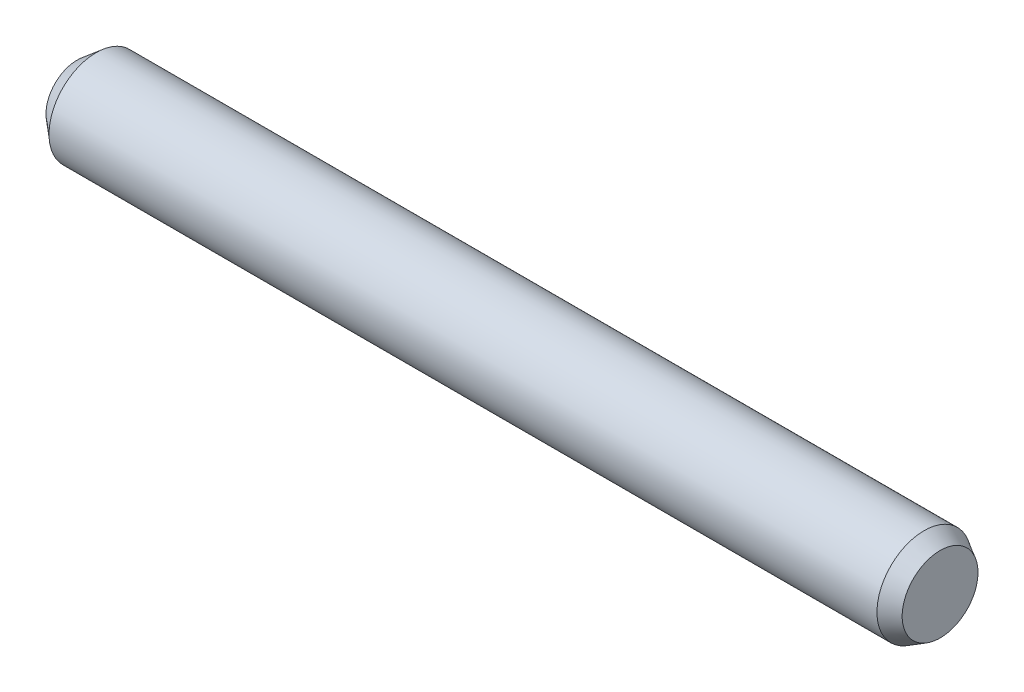
from build123d import *

# Parameters (mm, degrees)
CROQUIS1_R              = 1.475
SALIENTE_EXTRUIR1_DEPTH = 27
CHAFL_N1_SIZE           = 0.5
CHAFL_N1_SIZE2          = 0.288675135
CHAFL_N7_SIZE           = 0.5
CHAFL_N7_SIZE2          = 0.595876796


with BuildPart() as part:
    # Croquis1 → Saliente-Extruir1 (new body)
    with BuildSketch(Plane(origin=(0, 0, 0), x_dir=(0, 0, -1), z_dir=(1, 0, 0))):
        Circle(CROQUIS1_R)
    extrude(amount=SALIENTE_EXTRUIR1_DEPTH)

    # Chaflán1
    chafl_n1_edges = [part.edges().sort_by_distance(p)[0] for p in [
        (27, 0, 1.475),
    ]]
    chafl_n1_side = [part.faces().sort_by_distance(p)[0] for p in [
        (13.5, 0, 1.475),
    ]]
    chamfer(chafl_n1_edges, length=CHAFL_N1_SIZE, length2=CHAFL_N1_SIZE2, reference=chafl_n1_side[0])

    # Chaflán7
    chafl_n7_edges = [part.edges().sort_by_distance(p)[0] for p in [
        (0, 0, 1.475),
    ]]
    chafl_n7_side = [part.faces().sort_by_distance(p)[0] for p in [
        (0, 0, 0),
    ]]
    chamfer(chafl_n7_edges, length=CHAFL_N7_SIZE, length2=CHAFL_N7_SIZE2, reference=chafl_n7_side[0])


solid = part.part
